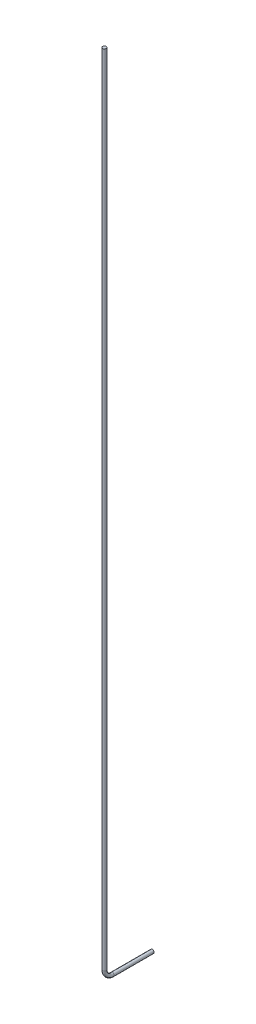
from build123d import *

# Parameters (mm, degrees)
SKETCH_1_R      = 1.13
EXTRUDE_1_DEPTH = 20
SKETCH_2_R      = 1.13


with BuildPart() as part:
    # ｽｹｯﾁ1 → ﾎﾞｽ - 押し出し1 (new body)
    with BuildSketch(Plane.XY):
        Circle(SKETCH_1_R)
    extrude(amount=EXTRUDE_1_DEPTH)

    # ｽｲｰﾌﾟ1: sweep along a path in ｽｹｯﾁ3
    with BuildLine(Plane(origin=(0, 0, 0), x_dir=(0, 0, -1), z_dir=(1, 0, 0))) as sweep_1_path:
        Line((-20, 0), (-25, 0))
        ThreePointArc((-25, 0), (-28.535533906, 1.464466094), (-30, 5))
        Line((-30, 5), (-30, 505))
    # ｽｹｯﾁ2 → ｽｲｰﾌﾟ1 (sweep)
    with BuildSketch(Plane.XY.offset(20)):
        Circle(SKETCH_2_R)
    sweep(path=sweep_1_path.line)


solid = part.part
